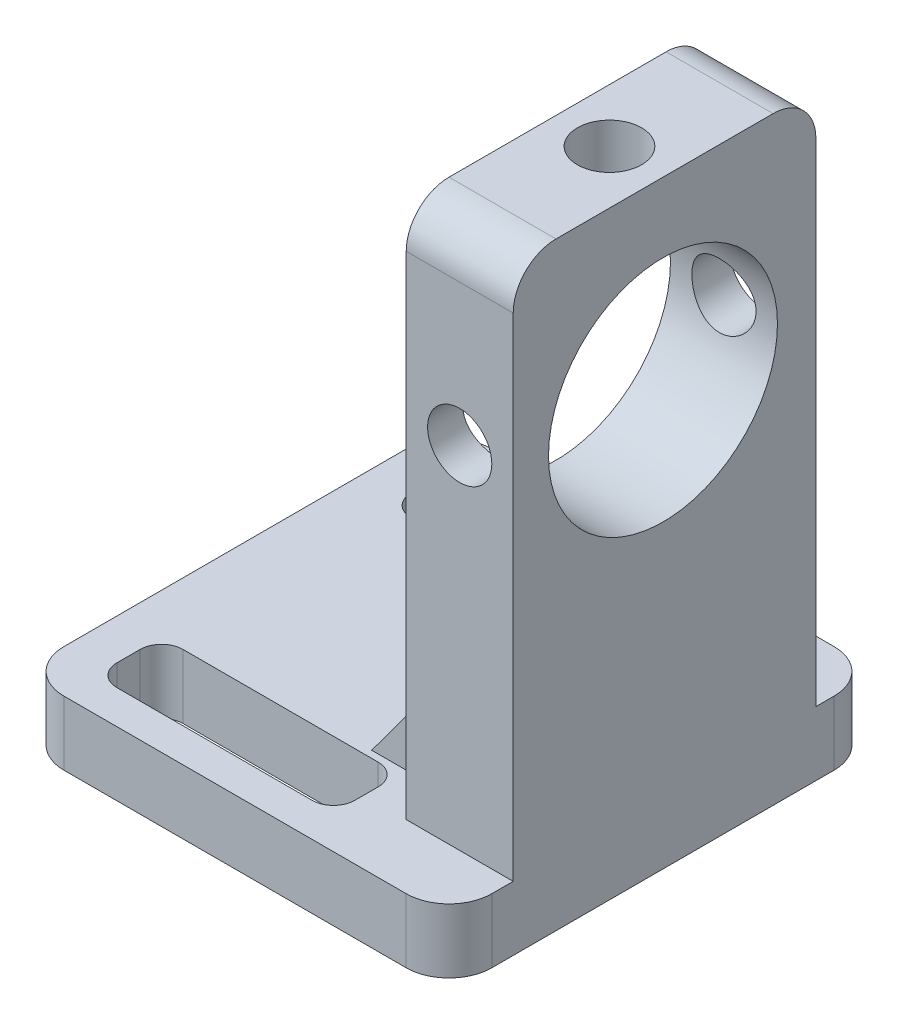
from build123d import *

# Parameters (mm, degrees)
SKETCH_1_W             = 20
SKETCH_1_H             = 20
EXTRUDE_1_DEPTH        = 3
SKETCH_2_W             = 5
SKETCH_2_H             = 14.146458656
EXTRUDE_2_DEPTH        = 25
SKETCH_3_R             = 5.35
CUT_EXTRUDE_2_DEPTH    = 5
SKETCH_7_W             = 11.125278603
SKETCH_7_H             = 3.091277008
CUT_EXTRUDE_6_DEPTH    = 10
FILLET_3_R             = 1
FILLET_3_OF_MIRROR_2_R = 1
EXTRUDE_3_DEPTH        = 5
EXTRUDE_3_DEPTH_BACK   = 5
FILLET_1_R             = 2
FILLET_2_R             = 2
SKETCH_11_R            = 1.5
CUT_EXTRUDE_7_DEPTH    = 5
SKETCH_12_R            = 1.5
CUT_EXTRUDE_8_DEPTH    = 5


with BuildPart() as part:
    # 草图1 → 凸台-拉伸1 (new body)
    with BuildSketch(Plane(origin=(0, 0, 0), x_dir=(1, 0, 0), z_dir=(0, 1, 0))):
        with Locations((-9.255516134, 0)):
            Rectangle(SKETCH_1_W, SKETCH_1_H)
    extrude(amount=EXTRUDE_1_DEPTH)

    # 草图2 → 凸台-拉伸2 (add)
    with BuildSketch(Plane(origin=(0, 3, 0), x_dir=(1, 0, 0), z_dir=(0, 1, 0))):
        with Locations((-1.755516134, 0.073229328)):
            Rectangle(SKETCH_2_W, SKETCH_2_H)
    extrude(amount=EXTRUDE_2_DEPTH)

    # 草图3 → 切除-拉伸2 (cut)
    with BuildSketch(Plane(origin=(0.744483866, 0, 0), x_dir=(0, 0, -1), z_dir=(1, 0, 0))):
        with Locations((0, 19.391413774)):
            Circle(SKETCH_3_R)
    extrude(amount=-CUT_EXTRUDE_2_DEPTH, mode=Mode.SUBTRACT)

    # 草图7 → 切除-拉伸6 (cut)
    with BuildSketch(Plane.XZ):
        with Locations((-11.79716819, -6.874153795)):
            Rectangle(SKETCH_7_W, SKETCH_7_H)
    cut_extrude_6 = extrude(amount=-CUT_EXTRUDE_6_DEPTH, mode=Mode.SUBTRACT)

    # 圆角3
    fillet_3_edges = [part.edges().sort_by_distance(p)[0] for p in [
        (-6.234528888, 1.5, -5.328515291),
        (-6.234528888, 1.5, -8.419792299),
        (-17.359807491, 1.5, -8.419792299),
        (-17.359807491, 1.5, -5.328515291),
    ]]
    fillet(fillet_3_edges, radius=FILLET_3_R)

    # 镜向2: 切除-拉伸6 across plane
    add(cut_extrude_6.mirror(Plane.XY), mode=Mode.SUBTRACT)

    # 圆角3 of 镜向2
    fillet_3_of_mirror_2_edges = [part.edges().sort_by_distance(p)[0] for p in [
        (-6.234528888, 1.5, 5.328515291),
        (-6.234528888, 1.5, 8.419792299),
        (-17.359807491, 1.5, 8.419792299),
        (-17.359807491, 1.5, 5.328515291),
    ]]
    fillet(fillet_3_of_mirror_2_edges, radius=FILLET_3_OF_MIRROR_2_R)

    # 圆角1
    fillet_1_edges = [part.edges().sort_by_distance(p)[0] for p in [
        (0.744483866, 1.5, 10),
        (-19.255516134, 1.5, 10),
        (-19.255516134, 1.5, -10),
        (0.744483866, 1.5, -10),
    ]]
    fillet(fillet_1_edges, radius=FILLET_1_R)

    # 圆角2
    fillet_2_edges = [part.edges().sort_by_distance(p)[0] for p in [
        (-1.755516134, 28, 7),
        (-1.755516134, 28, -7.146458656),
    ]]
    fillet(fillet_2_edges, radius=FILLET_2_R)

    # 草图11 → 切除-拉伸7 (cut)
    with BuildSketch(Plane(origin=(0, 0, -7.146458656), x_dir=(-1, 0, 0), z_dir=(0, 0, -1))):
        with Locations((1.755516134, 19.391413774)):
            Circle(SKETCH_11_R)
    cut_extrude_7 = extrude(amount=-CUT_EXTRUDE_7_DEPTH, mode=Mode.SUBTRACT)

    # 镜向3: 切除-拉伸7 across plane
    add(cut_extrude_7.mirror(Plane.XY), mode=Mode.SUBTRACT)

    # 草图12 → 切除-拉伸8 (cut)
    with BuildSketch(Plane(origin=(0, 28, 0), x_dir=(1, 0, 0), z_dir=(0, 1, 0))):
        with Locations(Location((-1.755516134, 0, 0), (0, 0, 270))):
            Circle(SKETCH_12_R)
    extrude(amount=-CUT_EXTRUDE_8_DEPTH, mode=Mode.SUBTRACT)


with BuildPart() as body_2:
    # 草图9 → 凸台-拉伸3 (new, two sides: drawn at the far end of the back side and taken through both)
    with BuildSketch(Plane.XY.offset(-EXTRUDE_3_DEPTH_BACK)):
        Polygon((-3.262396556, 2.292462797), (-8.391041548, 2.292462797), (-3.262396556, 9.237733311), align=None)
    extrude(amount=EXTRUDE_3_DEPTH + EXTRUDE_3_DEPTH_BACK)


solid = Compound([part.part, body_2.part])
